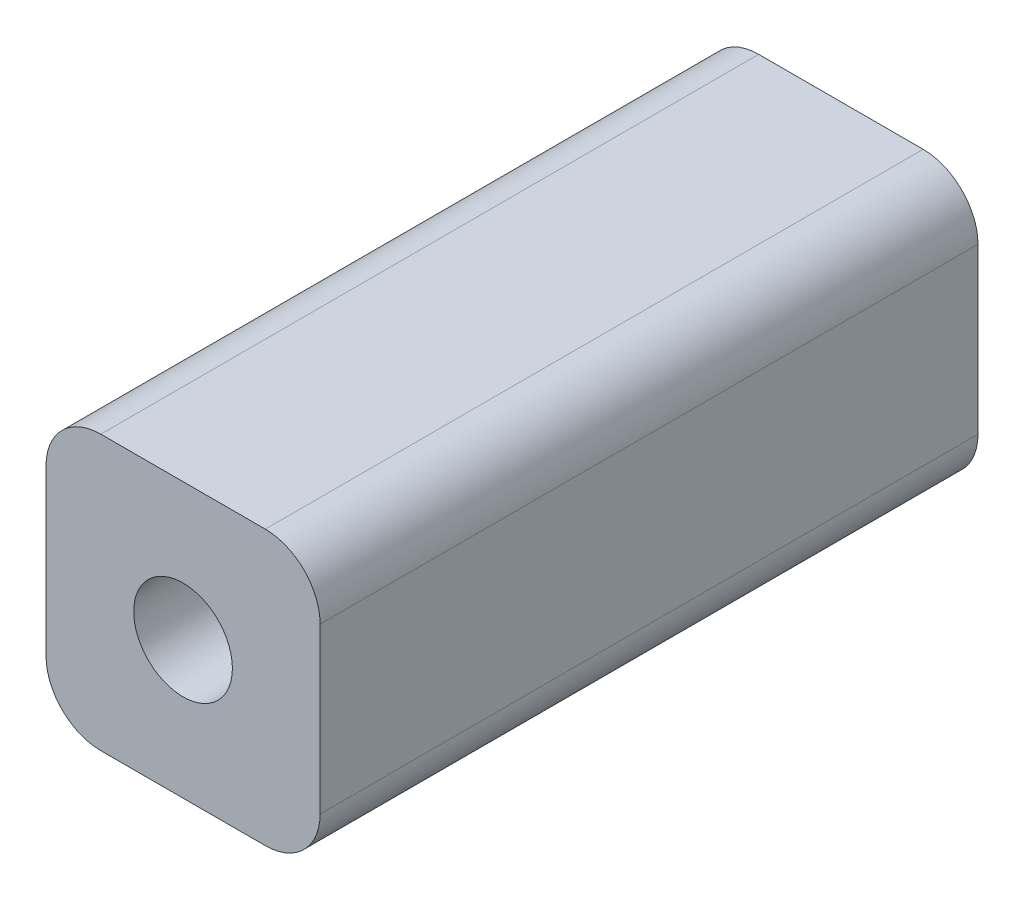
from build123d import *

# Parameters (mm, degrees)
SKETCH1_W            = 10
SKETCH1_H            = 10
BOSS_EXTRUDE1_DEPTH  = 24
M3_CLEARANCE_HOLE1_D = 3.6
FILLET1_R            = 2


with BuildPart() as part:
    # Sketch1 → Boss-Extrude1 (new body)
    with BuildSketch(Plane.XY):
        Rectangle(SKETCH1_W, SKETCH1_H)
    extrude(amount=BOSS_EXTRUDE1_DEPTH)

    # M3 Clearance Hole1 (through all)
    with Locations(Plane.XY.offset(24)):
        with Locations((0, 0)):
            Hole(M3_CLEARANCE_HOLE1_D / 2)

    # Fillet1
    fillet1_edges = [part.edges().sort_by_distance(p)[0] for p in [
        (5, -5, 12),
        (-5, -5, 12),
        (-5, 5, 12),
        (5, 5, 12),
    ]]
    fillet(fillet1_edges, radius=FILLET1_R)


solid = part.part
